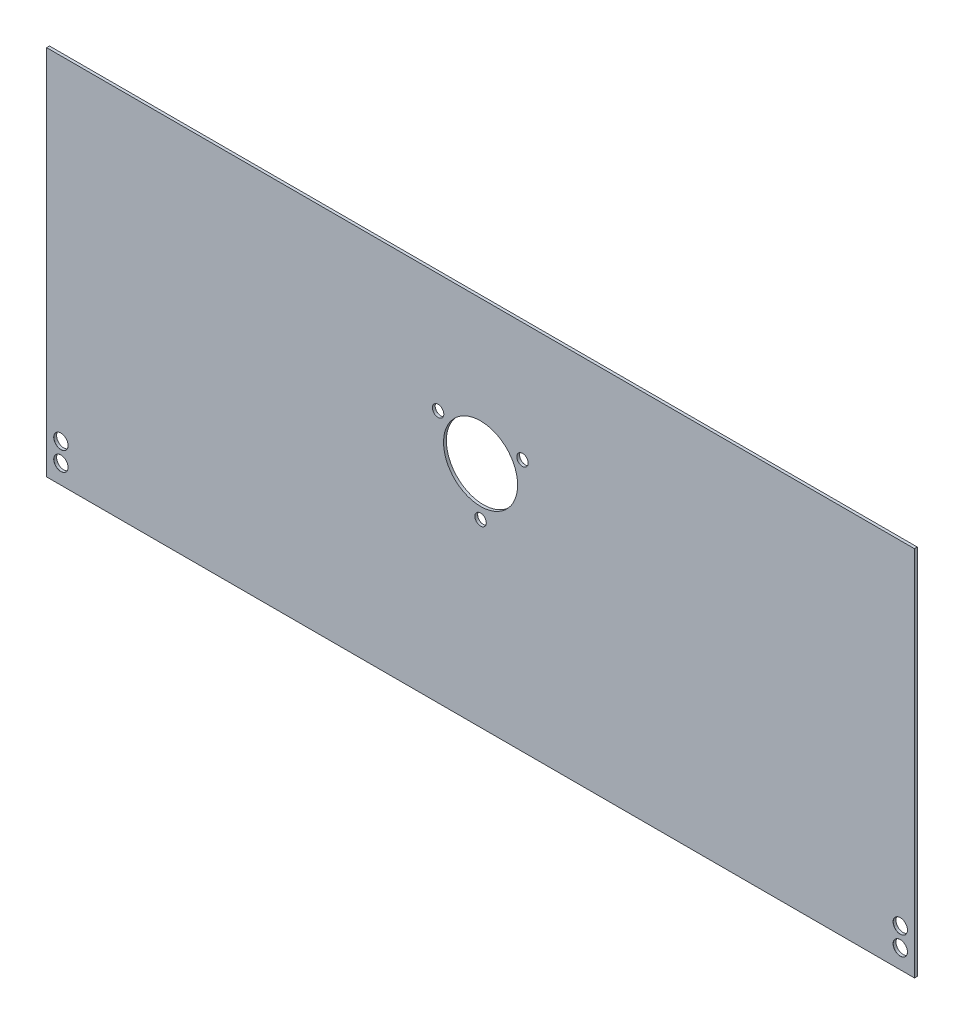
from build123d import *

# Parameters (mm, degrees)
BOSS_EXTRUDE2_DEPTH            = 1
F_5_0MM_DOWEL_HOLE4_AT_2_COUNT = 2
F_5_0MM_DOWEL_HOLE4_AT_2_PITCH = 6.666666667
F_5_0MM_DOWEL_HOLE4_AT_3_COUNT = 2
F_5_0MM_DOWEL_HOLE4_AT_3_PITCH = 294.8
F_5_0MM_DOWEL_HOLE4_AT_4_COUNT = 2
F_5_0MM_DOWEL_HOLE4_AT_4_PITCH = 294.875371037
F_4_0MM_DOWEL_HOLE1_AT_2_COUNT = 2
F_4_0MM_DOWEL_HOLE1_AT_2_PITCH = 29.641373273
F_4_0MM_DOWEL_HOLE1_AT_3_COUNT = 2
F_4_0MM_DOWEL_HOLE1_AT_3_PITCH = 29.619508559
SKETCH14_R                     = 13.01
CUT_EXTRUDE1_DEPTH             = 10
BOSS_EXTRUDE4_DEPTH            = 1


with BuildPart() as part:
    # Sketch1 → Boss-Extrude2 (new body)
    with BuildSketch(Plane.XY):
        with BuildLine():
            Line((-152.4, -80.25), (152.4, -80.25))
            Line((152.4, -80.25), (152.4, -60.25))
            ThreePointArc((152.4, -60.25), (0, 50.334231889), (-152.4, -60.25))
            Line((-152.4, -60.25), (-152.4, -80.25))
        make_face()
    extrude(amount=BOSS_EXTRUDE2_DEPTH)

    # Sketch9 → Ø5.0mm Dowel Hole4 (revolve, cut)
    with BuildSketch(Plane(origin=(-147.4, -66.916666667, 1), x_dir=(0, -1, 0), z_dir=(1, 0, 0))):
        Polygon((0, 0), (0, 2.502151548), (2.5, 1), (2.5, 0.025), (2.525, 0), align=None)
    f_5_0mm_dowel_hole4 = revolve(axis=Axis((-147.4, -66.916666667, 7.35), (0, 0, -1)), mode=Mode.SUBTRACT)

    # Ø5.0mm Dowel Hole4 at 2: Ø5.0mm Dowel Hole4 ×2
    with Locations(*[(0, -i * F_5_0MM_DOWEL_HOLE4_AT_2_PITCH, 0) for i in range(1, F_5_0MM_DOWEL_HOLE4_AT_2_COUNT)]):
        add(f_5_0mm_dowel_hole4, mode=Mode.SUBTRACT)

    # Ø5.0mm Dowel Hole4 at 3: Ø5.0mm Dowel Hole4 ×2
    with Locations(*[(i * F_5_0MM_DOWEL_HOLE4_AT_3_PITCH, 0, 0) for i in range(1, F_5_0MM_DOWEL_HOLE4_AT_3_COUNT)]):
        add(f_5_0mm_dowel_hole4, mode=Mode.SUBTRACT)

    # Ø5.0mm Dowel Hole4 at 4: Ø5.0mm Dowel Hole4 ×2
    with Locations(*[Vector(0.9997443969730838, -0.02260842146026871, 0) * (i * F_5_0MM_DOWEL_HOLE4_AT_4_PITCH) for i in range(1, F_5_0MM_DOWEL_HOLE4_AT_4_COUNT)]):
        add(f_5_0mm_dowel_hole4, mode=Mode.SUBTRACT)

    # Sketch13 → Ø4.0mm Dowel Hole1 (revolve, cut)
    with BuildSketch(Plane(origin=(-14.91881086, 8.587973147, 0), x_dir=(0, 1, 0), z_dir=(1, 0, 0))):
        Polygon((0, 0), (0, 1), (2, 1), (2, 0.025), (2.025, 0), align=None)
    f_4_0mm_dowel_hole1 = revolve(axis=Axis((-14.91881086, 8.587973147, -6.35), (0, 0, 1)), mode=Mode.SUBTRACT)

    # Ø4.0mm Dowel Hole1 at 2: Ø4.0mm Dowel Hole1 ×2
    with Locations(*[Vector(0.9999955957234619, -0.0029679173975410726, 0) * (i * F_4_0MM_DOWEL_HOLE1_AT_2_PITCH) for i in range(1, F_4_0MM_DOWEL_HOLE1_AT_2_COUNT)]):
        add(f_4_0mm_dowel_hole1, mode=Mode.SUBTRACT)

    # Ø4.0mm Dowel Hole1 at 3: Ø4.0mm Dowel Hole1 ×2
    with Locations(*[Vector(0.5036819172784638, -0.8638891863003557, 0) * (i * F_4_0MM_DOWEL_HOLE1_AT_3_PITCH) for i in range(1, F_4_0MM_DOWEL_HOLE1_AT_3_COUNT)]):
        add(f_4_0mm_dowel_hole1, mode=Mode.SUBTRACT)

    # Sketch14 → Cut-Extrude1 (cut)
    with BuildSketch(Plane(origin=(0, 0, 0), x_dir=(-1, 0, 0), z_dir=(0, 0, -1))):
        Circle(SKETCH14_R)
    extrude(amount=-CUT_EXTRUDE1_DEPTH, mode=Mode.SUBTRACT)

    # Sketch15 → Boss-Extrude4 (add)
    with BuildSketch(Plane(origin=(0, 0, 0), x_dir=(-1, 0, 0), z_dir=(0, 0, -1))):
        with BuildLine():
            ThreePointArc((-152.4, -60.25), (0, 40.202429788), (152.4, -60.25))
            ThreePointArc((152.4, -60.25), (0, 50.334231889), (-152.4, -60.25))
        make_face()
        with BuildLine():
            Line((-152.4, 50.334231889), (-152.4, -60.25))
            ThreePointArc((-152.4, -60.25), (-94.147002198, 19.775508453), (8.24e-07, 50.334231889))
            Line((8.24e-07, 50.334231889), (-152.4, 50.334231889))
        make_face()
        with BuildLine():
            ThreePointArc((8.24e-07, 50.334231889), (94.147002865, 19.775507969), (152.4, -60.25))
            Line((152.4, -60.25), (152.4, 50.334231889))
            Line((152.4, 50.334231889), (8.24e-07, 50.334231889))
        make_face()
    extrude(amount=-BOSS_EXTRUDE4_DEPTH)


solid = part.part
